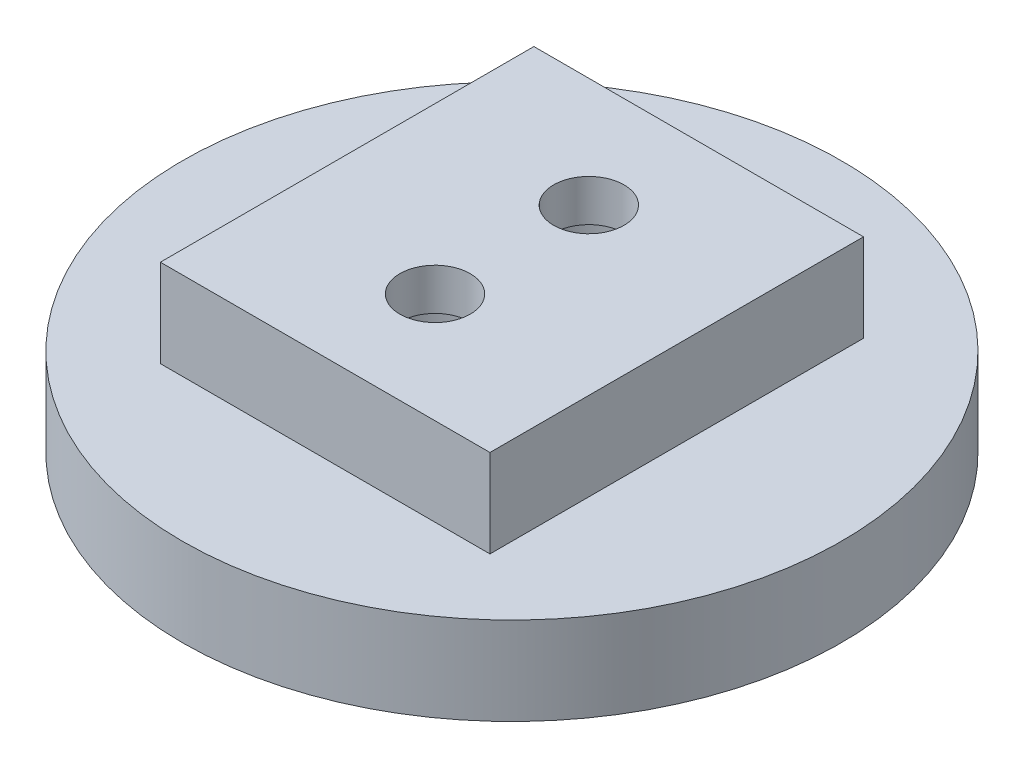
from build123d import *

# Parameters (mm, degrees)
SKETCH2_R           = 15
BOSS_EXTRUDE1_DEPTH = 4
SKETCH3_W           = 15
SKETCH3_H           = 17
BOSS_EXTRUDE2_DEPTH = 4
SKETCH4_R           = 1.6
CUT_EXTRUDE1_DEPTH  = 23.671568098
SKETCH5_R           = 2.95
CUT_EXTRUDE2_DEPTH  = 6.1


with BuildPart() as part:
    # Sketch2 → Boss-Extrude1 (new body)
    with BuildSketch(Plane(origin=(0, 0, 0), x_dir=(1, 0, 0), z_dir=(0, 1, 0))):
        with Locations(Location((0, 0, 0), (0, 0, 270))):
            Circle(SKETCH2_R)
    extrude(amount=BOSS_EXTRUDE1_DEPTH)

    # Sketch3 → Boss-Extrude2 (add)
    with BuildSketch(Plane(origin=(0, 4, 0), x_dir=(1, 0, 0), z_dir=(0, 1, 0))):
        Rectangle(SKETCH3_W, SKETCH3_H)
    extrude(amount=BOSS_EXTRUDE2_DEPTH)

    # Sketch4 → Cut-Extrude1 (cut, through all)
    with BuildSketch(Plane(origin=(0, 8, 0), x_dir=(1, 0, 0), z_dir=(0, 1, 0))):
        with Locations(Location((0, 3.5, 0), (0, 0, 270))):
            Circle(SKETCH4_R)
        with Locations(Location((0, -3.5, 0), (0, 0, 90))):
            Circle(SKETCH4_R)
    extrude(amount=-CUT_EXTRUDE1_DEPTH, mode=Mode.SUBTRACT)

    # Sketch5 → Cut-Extrude2 (cut)
    with BuildSketch(Plane.XZ):
        with Locations(Location((0, 3.5, 0), (0, 0, 270))):
            Circle(SKETCH5_R)
        with Locations(Location((0, -3.5, 0), (0, 0, 90))):
            Circle(SKETCH5_R)
    extrude(amount=-CUT_EXTRUDE2_DEPTH, mode=Mode.SUBTRACT)


solid = part.part
